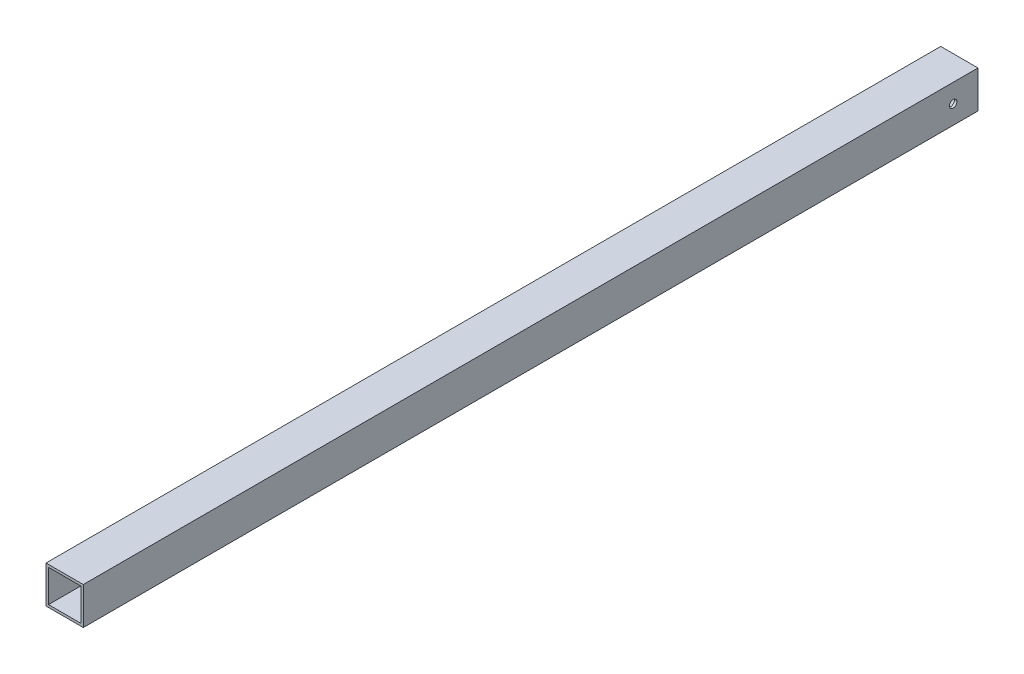
from build123d import *

# Parameters (mm, degrees)
SKETCH_1_W          = 15
SKETCH_1_H          = 15
SKETCH_1_W_2        = 13
SKETCH_1_H_2        = 13
EXTRUDE_1_DEPTH     = 360
SKETCH_2_R          = 1.5
CUT_EXTRUDE_1_DEPTH = 25


with BuildPart() as part:
    # 草图1 → 凸台-拉伸1 (new body)
    with BuildSketch(Plane.XY):
        Rectangle(SKETCH_1_W, SKETCH_1_H)
        Rectangle(SKETCH_1_W_2, SKETCH_1_H_2, mode=Mode.SUBTRACT)
    extrude(amount=EXTRUDE_1_DEPTH)

    # 草图2 → 切除-拉伸1 (cut)
    with BuildSketch(Plane.ZY.offset(7.5)):
        with Locations(Location((10, 0, 0), (0, 0, 270))):
            Circle(SKETCH_2_R)
    extrude(amount=-CUT_EXTRUDE_1_DEPTH, mode=Mode.SUBTRACT)


solid = part.part
